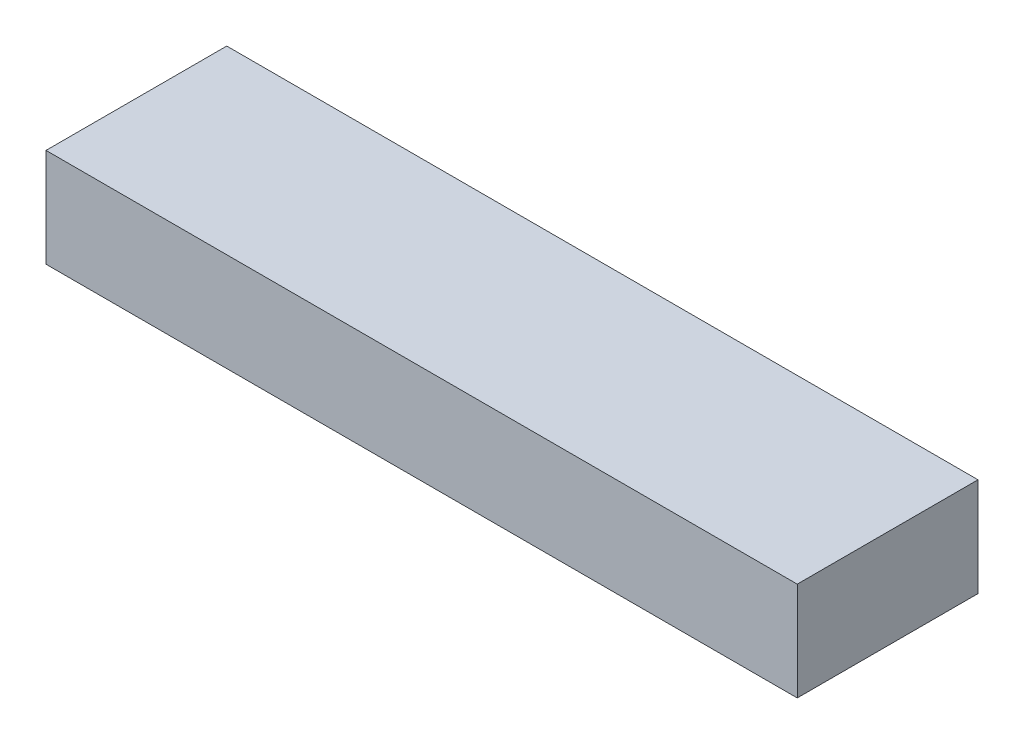
from build123d import *

# Parameters (mm, degrees)
SKETCH1_W           = 228.6
SKETCH1_H           = 55
BOSS_EXTRUDE1_DEPTH = 30


with BuildPart() as part:
    # Sketch1 → Boss-Extrude1 (new body)
    with BuildSketch(Plane(origin=(0, 0, 0), x_dir=(1, 0, 0), z_dir=(0, 1, 0))):
        Rectangle(SKETCH1_W, SKETCH1_H)
    extrude(amount=BOSS_EXTRUDE1_DEPTH)


solid = part.part
